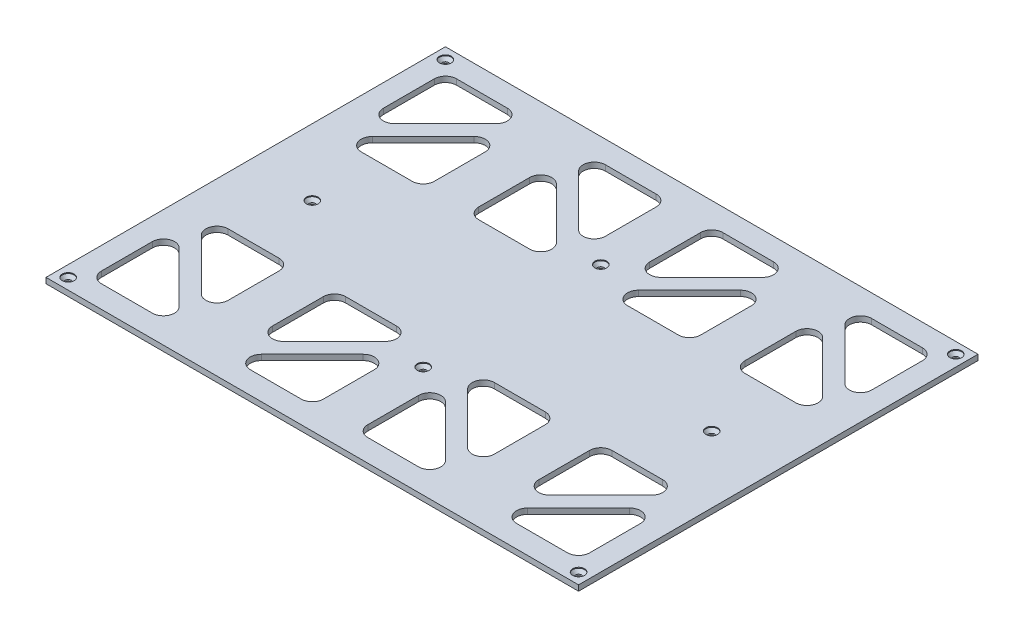
from build123d import *

# Parameters (mm, degrees)
SKETCH2_W                                    = 609.6
SKETCH2_H                                    = 457.2
BOSS_EXTRUDE1_DEPTH                          = 6.35
CSK_FOR_1_4_FLAT_HEAD_SOCKET_CAP_SCR_2_COUNT = 2
CSK_FOR_1_4_FLAT_HEAD_SOCKET_CAP_SCR_2_PITCH = 225.044573363
CSK_FOR_1_4_FLAT_HEAD_SOCKET_CAP_SCR_3_COUNT = 2
CSK_FOR_1_4_FLAT_HEAD_SOCKET_CAP_SCR_3_PITCH = 431.8
CSK_FOR_1_4_FLAT_HEAD_SOCKET_CAP_SCR_4_COUNT = 2
CSK_FOR_1_4_FLAT_HEAD_SOCKET_CAP_SCR_4_PITCH = 431.426308887
CSK_FOR_1_4_FLAT_HEAD_SOCKET_CAP_SCR_5_COUNT = 2
CSK_FOR_1_4_FLAT_HEAD_SOCKET_CAP_SCR_5_PITCH = 313.666861495
CSK_FOR_1_4_FLAT_HEAD_SOCKET_CAP_SCR_6_COUNT = 2
CSK_FOR_1_4_FLAT_HEAD_SOCKET_CAP_SCR_6_PITCH = 584.2
CSK_FOR_1_4_FLAT_HEAD_SOCKET_CAP_SCR_7_COUNT = 2
CSK_FOR_1_4_FLAT_HEAD_SOCKET_CAP_SCR_7_PITCH = 563.685461938
CSK_FOR_1_4_FLAT_HEAD_SOCKET_CAP_SCR_8_COUNT = 2
CSK_FOR_1_4_FLAT_HEAD_SOCKET_CAP_SCR_8_PITCH = 726.457762021


with BuildPart() as part:
    # Sketch2 → Boss-Extrude1 (new body)
    with BuildSketch(Plane(origin=(0, 0, 0), x_dir=(1, 0, 0), z_dir=(0, 1, 0))):
        with Locations((39.071311338, -112.036262161)):
            Rectangle(SKETCH2_W, SKETCH2_H)
        with BuildLine():
            Line((-240.328688662, 78.463737839), (-240.328688662, 20.224250081))
            ThreePointArc((-240.328688662, 20.224250081), (-232.488768253, 8.490980019), (-218.648432541, 11.24399396))
            Line((-218.648432541, 11.24399396), (-160.408944783, 69.483481718))
            ThreePointArc((-160.408944783, 69.483481718), (-157.655930841, 83.32381743), (-169.389200904, 91.163737839))
            Line((-169.389200904, 91.163737839), (-227.628688662, 91.163737839))
            ThreePointArc((-227.628688662, 91.163737839), (-236.608944783, 87.44399396), (-240.328688662, 78.463737839))
        make_face(mode=Mode.SUBTRACT)
        with BuildLine():
            Line((-218.648432541, -14.15600604), (-160.408944783, 44.083481718))
            ThreePointArc((-160.408944783, 44.083481718), (-146.568609071, 46.83649566), (-138.728688662, 35.103225597))
            Line((-138.728688662, 35.103225597), (-138.728688662, -23.136262161))
            ThreePointArc((-138.728688662, -23.136262161), (-142.448432541, -32.116518282), (-151.428688662, -35.836262161))
            Line((-151.428688662, -35.836262161), (-209.668176419, -35.836262161))
            ThreePointArc((-209.668176419, -35.836262161), (-221.401446482, -27.996341752), (-218.648432541, -14.15600604))
        make_face(mode=Mode.SUBTRACT)
        with BuildLine():
            Line((-75.228688662, -35.836262161), (-16.989200904, -35.836262161))
            ThreePointArc((-16.989200904, -35.836262161), (-5.255930841, -27.996341752), (-8.008944783, -14.15600604))
            Line((-8.008944783, -14.15600604), (-66.248432541, 44.083481718))
            ThreePointArc((-66.248432541, 44.083481718), (-80.088768253, 46.83649566), (-87.928688662, 35.103225597))
            Line((-87.928688662, 35.103225597), (-87.928688662, -23.136262161))
            ThreePointArc((-87.928688662, -23.136262161), (-84.208944783, -32.116518282), (-75.228688662, -35.836262161))
        make_face(mode=Mode.SUBTRACT)
        with BuildLine():
            Line((-57.268176419, 91.163737839), (0.971311338, 91.163737839))
            ThreePointArc((0.971311338, 91.163737839), (9.951567459, 87.44399396), (13.671311338, 78.463737839))
            Line((13.671311338, 78.463737839), (13.671311338, 20.224250081))
            ThreePointArc((13.671311338, 20.224250081), (5.831390929, 8.490980019), (-8.008944783, 11.24399396))
            Line((-8.008944783, 11.24399396), (-66.248432541, 69.483481718))
            ThreePointArc((-66.248432541, 69.483481718), (-69.001446482, 83.32381743), (-57.268176419, 91.163737839))
        make_face(mode=Mode.SUBTRACT)
        with BuildLine():
            Line((64.471311338, 78.463737839), (64.471311338, 20.224250081))
            ThreePointArc((64.471311338, 20.224250081), (72.311231747, 8.490980019), (86.151567459, 11.24399396))
            Line((86.151567459, 11.24399396), (144.391055217, 69.483481718))
            ThreePointArc((144.391055217, 69.483481718), (147.144069159, 83.32381743), (135.410799096, 91.163737839))
            Line((135.410799096, 91.163737839), (77.171311338, 91.163737839))
            ThreePointArc((77.171311338, 91.163737839), (68.191055217, 87.44399396), (64.471311338, 78.463737839))
        make_face(mode=Mode.SUBTRACT)
        with BuildLine():
            Line((86.151567459, -14.15600604), (144.391055217, 44.083481718))
            ThreePointArc((144.391055217, 44.083481718), (158.231390929, 46.83649566), (166.071311338, 35.103225597))
            Line((166.071311338, 35.103225597), (166.071311338, -23.136262161))
            ThreePointArc((166.071311338, -23.136262161), (162.351567459, -32.116518282), (153.371311338, -35.836262161))
            Line((153.371311338, -35.836262161), (95.131823581, -35.836262161))
            ThreePointArc((95.131823581, -35.836262161), (83.398553518, -27.996341752), (86.151567459, -14.15600604))
        make_face(mode=Mode.SUBTRACT)
        with BuildLine():
            Line((229.571311338, -35.836262161), (287.810799096, -35.836262161))
            ThreePointArc((287.810799096, -35.836262161), (299.544069159, -27.996341752), (296.791055217, -14.15600604))
            Line((296.791055217, -14.15600604), (238.551567459, 44.083481718))
            ThreePointArc((238.551567459, 44.083481718), (224.711231747, 46.83649566), (216.871311338, 35.103225597))
            Line((216.871311338, 35.103225597), (216.871311338, -23.136262161))
            ThreePointArc((216.871311338, -23.136262161), (220.591055217, -32.116518282), (229.571311338, -35.836262161))
        make_face(mode=Mode.SUBTRACT)
        with BuildLine():
            Line((247.531823581, 91.163737839), (305.771311338, 91.163737839))
            ThreePointArc((305.771311338, 91.163737839), (314.751567459, 87.44399396), (318.471311338, 78.463737839))
            Line((318.471311338, 78.463737839), (318.471311338, 20.224250081))
            ThreePointArc((318.471311338, 20.224250081), (310.631390929, 8.490980019), (296.791055217, 11.24399396))
            Line((296.791055217, 11.24399396), (238.551567459, 69.483481718))
            ThreePointArc((238.551567459, 69.483481718), (235.798553518, 83.32381743), (247.531823581, 91.163737839))
        make_face(mode=Mode.SUBTRACT)
        with BuildLine():
            Line((318.471311338, -302.536262161), (318.471311338, -244.296774403))
            ThreePointArc((318.471311338, -244.296774403), (310.631390929, -232.56350434), (296.791055217, -235.316518282))
            Line((296.791055217, -235.316518282), (238.551567459, -293.55600604))
            ThreePointArc((238.551567459, -293.55600604), (235.798553518, -307.396341752), (247.531823581, -315.236262161))
            Line((247.531823581, -315.236262161), (305.771311338, -315.236262161))
            ThreePointArc((305.771311338, -315.236262161), (314.751567459, -311.516518282), (318.471311338, -302.536262161))
        make_face(mode=Mode.SUBTRACT)
        with BuildLine():
            Line((296.791055217, -209.916518282), (238.551567459, -268.15600604))
            ThreePointArc((238.551567459, -268.15600604), (224.711231747, -270.909019981), (216.871311338, -259.175749919))
            Line((216.871311338, -259.175749919), (216.871311338, -200.936262161))
            ThreePointArc((216.871311338, -200.936262161), (220.591055217, -191.95600604), (229.571311338, -188.236262161))
            Line((229.571311338, -188.236262161), (287.810799096, -188.236262161))
            ThreePointArc((287.810799096, -188.236262161), (299.544069159, -196.07618257), (296.791055217, -209.916518282))
        make_face(mode=Mode.SUBTRACT)
        with BuildLine():
            Line((153.371311338, -188.236262161), (95.131823581, -188.236262161))
            ThreePointArc((95.131823581, -188.236262161), (83.398553518, -196.07618257), (86.151567459, -209.916518282))
            Line((86.151567459, -209.916518282), (144.391055217, -268.15600604))
            ThreePointArc((144.391055217, -268.15600604), (158.231390929, -270.909019981), (166.071311338, -259.175749919))
            Line((166.071311338, -259.175749919), (166.071311338, -200.936262161))
            ThreePointArc((166.071311338, -200.936262161), (162.351567459, -191.95600604), (153.371311338, -188.236262161))
        make_face(mode=Mode.SUBTRACT)
        with BuildLine():
            Line((135.410799096, -315.236262161), (77.171311338, -315.236262161))
            ThreePointArc((77.171311338, -315.236262161), (68.191055217, -311.516518282), (64.471311338, -302.536262161))
            Line((64.471311338, -302.536262161), (64.471311338, -244.296774403))
            ThreePointArc((64.471311338, -244.296774403), (72.311231747, -232.56350434), (86.151567459, -235.316518282))
            Line((86.151567459, -235.316518282), (144.391055217, -293.55600604))
            ThreePointArc((144.391055217, -293.55600604), (147.144069159, -307.396341752), (135.410799096, -315.236262161))
        make_face(mode=Mode.SUBTRACT)
        with BuildLine():
            Line((13.671311338, -302.536262161), (13.671311338, -244.296774403))
            ThreePointArc((13.671311338, -244.296774403), (5.831390929, -232.56350434), (-8.008944783, -235.316518282))
            Line((-8.008944783, -235.316518282), (-66.248432541, -293.55600604))
            ThreePointArc((-66.248432541, -293.55600604), (-69.001446482, -307.396341752), (-57.268176419, -315.236262161))
            Line((-57.268176419, -315.236262161), (0.971311338, -315.236262161))
            ThreePointArc((0.971311338, -315.236262161), (9.951567459, -311.516518282), (13.671311338, -302.536262161))
        make_face(mode=Mode.SUBTRACT)
        with BuildLine():
            Line((-8.008944783, -209.916518282), (-66.248432541, -268.15600604))
            ThreePointArc((-66.248432541, -268.15600604), (-80.088768253, -270.909019981), (-87.928688662, -259.175749919))
            Line((-87.928688662, -259.175749919), (-87.928688662, -200.936262161))
            ThreePointArc((-87.928688662, -200.936262161), (-84.208944783, -191.95600604), (-75.228688662, -188.236262161))
            Line((-75.228688662, -188.236262161), (-16.989200904, -188.236262161))
            ThreePointArc((-16.989200904, -188.236262161), (-5.255930841, -196.07618257), (-8.008944783, -209.916518282))
        make_face(mode=Mode.SUBTRACT)
        with BuildLine():
            Line((-151.428688662, -188.236262161), (-209.668176419, -188.236262161))
            ThreePointArc((-209.668176419, -188.236262161), (-221.401446482, -196.07618257), (-218.648432541, -209.916518282))
            Line((-218.648432541, -209.916518282), (-160.408944783, -268.15600604))
            ThreePointArc((-160.408944783, -268.15600604), (-146.568609071, -270.909019981), (-138.728688662, -259.175749919))
            Line((-138.728688662, -259.175749919), (-138.728688662, -200.936262161))
            ThreePointArc((-138.728688662, -200.936262161), (-142.448432541, -191.95600604), (-151.428688662, -188.236262161))
        make_face(mode=Mode.SUBTRACT)
        with BuildLine():
            Line((-169.389200904, -315.236262161), (-227.628688662, -315.236262161))
            ThreePointArc((-227.628688662, -315.236262161), (-236.608944783, -311.516518282), (-240.328688662, -302.536262161))
            Line((-240.328688662, -302.536262161), (-240.328688662, -244.296774403))
            ThreePointArc((-240.328688662, -244.296774403), (-232.488768253, -232.56350434), (-218.648432541, -235.316518282))
            Line((-218.648432541, -235.316518282), (-160.408944783, -293.55600604))
            ThreePointArc((-160.408944783, -293.55600604), (-157.655930841, -307.396341752), (-169.389200904, -315.236262161))
        make_face(mode=Mode.SUBTRACT)
    extrude(amount=BOSS_EXTRUDE1_DEPTH)

    # Sketch5 → CSK for 1/4 Flat Head Socket Cap Screw1 (revolve, cut)
    with BuildSketch(Plane(origin=(-253.028688662, 6.35, -103.863737839), x_dir=(0, 0, 1), z_dir=(1, 0, 0))):
        Polygon((0, 0), (0, 6.35), (3.57124, 6.35), (3.57124, 4.665497757), (6.7437, 1.016), (6.7437, 0), align=None)
    csk_for_1_4_flat_head_socket_cap_screw1 = revolve(axis=Axis((-253.028688662, 12.7, -103.863737839), (0, -1, 0)), mode=Mode.SUBTRACT)

    # CSK for 1_4 Flat Head Socket Cap Scr 2: CSK for 1/4 Flat Head Socket Cap Screw1 ×2
    with Locations(*[Vector(0.28216632399155034, 0, 0.9593655015712705) * (i * CSK_FOR_1_4_FLAT_HEAD_SOCKET_CAP_SCR_2_PITCH) for i in range(1, CSK_FOR_1_4_FLAT_HEAD_SOCKET_CAP_SCR_2_COUNT)]):
        add(csk_for_1_4_flat_head_socket_cap_screw1, mode=Mode.SUBTRACT)

    # CSK for 1_4 Flat Head Socket Cap Scr 3: CSK for 1/4 Flat Head Socket Cap Screw1 ×2
    with Locations(*[(0, 0, i * CSK_FOR_1_4_FLAT_HEAD_SOCKET_CAP_SCR_3_PITCH) for i in range(1, CSK_FOR_1_4_FLAT_HEAD_SOCKET_CAP_SCR_3_COUNT)]):
        add(csk_for_1_4_flat_head_socket_cap_screw1, mode=Mode.SUBTRACT)

    # CSK for 1_4 Flat Head Socket Cap Scr 4: CSK for 1/4 Flat Head Socket Cap Screw1 ×2
    with Locations(*[Vector(0.6770565308208836, 0, 0.7359310117618295) * (i * CSK_FOR_1_4_FLAT_HEAD_SOCKET_CAP_SCR_4_PITCH) for i in range(1, CSK_FOR_1_4_FLAT_HEAD_SOCKET_CAP_SCR_4_COUNT)]):
        add(csk_for_1_4_flat_head_socket_cap_screw1, mode=Mode.SUBTRACT)

    # CSK for 1_4 Flat Head Socket Cap Scr 5: CSK for 1/4 Flat Head Socket Cap Screw1 ×2
    with Locations(*[Vector(0.9312427797057535, 0, 0.364399348580512) * (i * CSK_FOR_1_4_FLAT_HEAD_SOCKET_CAP_SCR_5_PITCH) for i in range(1, CSK_FOR_1_4_FLAT_HEAD_SOCKET_CAP_SCR_5_COUNT)]):
        add(csk_for_1_4_flat_head_socket_cap_screw1, mode=Mode.SUBTRACT)

    # CSK for 1_4 Flat Head Socket Cap Scr 6: CSK for 1/4 Flat Head Socket Cap Screw1 ×2
    with Locations(*[(i * CSK_FOR_1_4_FLAT_HEAD_SOCKET_CAP_SCR_6_PITCH, 0, 0) for i in range(1, CSK_FOR_1_4_FLAT_HEAD_SOCKET_CAP_SCR_6_COUNT)]):
        add(csk_for_1_4_flat_head_socket_cap_screw1, mode=Mode.SUBTRACT)

    # CSK for 1_4 Flat Head Socket Cap Scr 7: CSK for 1/4 Flat Head Socket Cap Screw1 ×2
    with Locations(*[Vector(0.9237421135716327, 0, 0.38301502270043275) * (i * CSK_FOR_1_4_FLAT_HEAD_SOCKET_CAP_SCR_7_PITCH) for i in range(1, CSK_FOR_1_4_FLAT_HEAD_SOCKET_CAP_SCR_7_COUNT)]):
        add(csk_for_1_4_flat_head_socket_cap_screw1, mode=Mode.SUBTRACT)

    # CSK for 1_4 Flat Head Socket Cap Scr 8: CSK for 1/4 Flat Head Socket Cap Screw1 ×2
    with Locations(*[Vector(0.8041761414663257, 0, 0.5943910610838057) * (i * CSK_FOR_1_4_FLAT_HEAD_SOCKET_CAP_SCR_8_PITCH) for i in range(1, CSK_FOR_1_4_FLAT_HEAD_SOCKET_CAP_SCR_8_COUNT)]):
        add(csk_for_1_4_flat_head_socket_cap_screw1, mode=Mode.SUBTRACT)


solid = part.part
